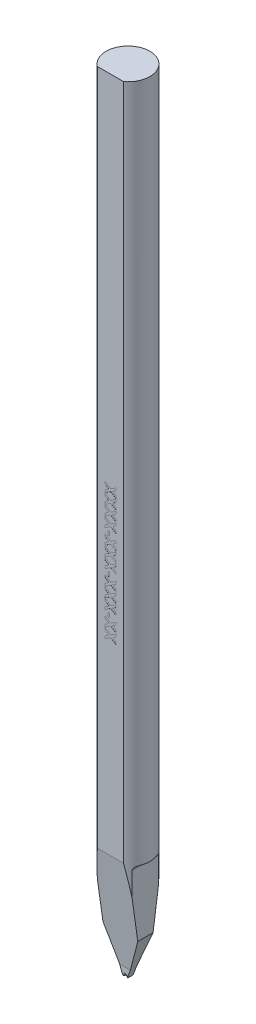
from build123d import *

# Parameters (mm, degrees)
SKETCH_TL_CUTTING_R       = 1.99771
TL_CUTTING_DEPTH          = 72.009
SKETCH_TDF_GRINDING_W     = 4.01542
SKETCH_TDF_GRINDING_H     = 4.01542
TDF_GRINDING_DEPTH        = 73.064400167
SKETCH_ENGRAVING_W        = 0.166666667
SKETCH_ENGRAVING_H        = 0.371794872
ENGRAVING_DEPTH           = 0.005
VW_VR_GRINDING_DEPTH      = 2.00771
VW_VR_GRINDING_DEPTH_BACK = 2.00771
ISA_GRINDING_DEPTH        = 2.00771
ISA_GRINDING_DEPTH_BACK   = 2.00771
PRE_FRX_BRX_DEPTH         = 2.00771
PRE_FRX_BRX_DEPTH_BACK    = 2.00771
SKETCH_PRE_FRX_BRX_W      = 1.7372
SKETCH_PRE_FRX_BRX_H      = 0.78994
FR_EDM_R                  = 0.20066
BR_EDM_R                  = 0.09906
FA_BA_GRINDING_DEPTH      = 2.00771
FA_BA_GRINDING_DEPTH_BACK = 2.00771


with BuildPart() as part:
    # sketch_TL_cutting → TL_cutting (new body)
    with BuildSketch(Plane(origin=(0, 0, 0), x_dir=(1, 0, 0), z_dir=(0, 1, 0))):
        with Locations(Location((0, 0, 0), (0, 0, 270))):
            Circle(SKETCH_TL_CUTTING_R)
    extrude(amount=TL_CUTTING_DEPTH)

    # sketch_TDF_grinding → TDF_grinding (cut, through all)
    with BuildSketch(Plane(origin=(0, 0, 0), x_dir=(1, 0, 0), z_dir=(0, 1, 0))):
        with Locations((0, -3.60918)):
            Rectangle(SKETCH_TDF_GRINDING_W, SKETCH_TDF_GRINDING_H)
    extrude(amount=TDF_GRINDING_DEPTH, mode=Mode.SUBTRACT)

    # sketch_engraving → engraving (cut)
    with BuildSketch(Plane.XY.offset(1.60147)):
        Polygon((-0.5, 39.598539744), (0.029647436, 39.255791346), (0.5, 39.560078205), (0.5, 39.33531859), (0.203325321, 39.143411538), (0.5, 38.951504487), (0.5, 38.726744872), (0.029647436, 39.031031731), (-0.5, 38.688283333), (-0.5, 38.913042949), (-0.144030449, 39.143411538), (-0.5, 39.373780128), align=None)
        Polygon((-0.5, 38.675462821), (0.029647436, 38.332714423), (0.5, 38.637001282), (0.5, 38.412241667), (0.203325321, 38.220334615), (0.5, 38.028427564), (0.5, 37.803667949), (0.029647436, 38.107954808), (-0.5, 37.76520641), (-0.5, 37.989966026), (-0.144030449, 38.220334615), (-0.5, 38.450703205), align=None)
        Polygon((-0.5, 37.752385897), (0.029647436, 37.4096375), (0.5, 37.713924359), (0.5, 37.489164744), (0.203325321, 37.297257692), (0.5, 37.105350641), (0.5, 36.880591026), (0.029647436, 37.184877885), (-0.5, 36.842129487), (-0.5, 37.066889103), (-0.144030449, 37.297257692), (-0.5, 37.527626282), align=None)
        Polygon((-0.5, 36.829308974), (0.029647436, 36.486560577), (0.5, 36.790847436), (0.5, 36.566087821), (0.203325321, 36.374180769), (0.5, 36.182273718), (0.5, 35.957514103), (0.029647436, 36.261800962), (-0.5, 35.919052564), (-0.5, 36.143812179), (-0.144030449, 36.374180769), (-0.5, 36.604549359), align=None)
        with Locations((-0.147435898, 35.649821795)):
            Rectangle(SKETCH_ENGRAVING_W, SKETCH_ENGRAVING_H)
        Polygon((-0.5, 35.44469359), (0.029647436, 35.101945192), (0.5, 35.406232051), (0.5, 35.181472436), (0.203325321, 34.989565385), (0.5, 34.797658333), (0.5, 34.572898718), (0.029647436, 34.877185577), (-0.5, 34.534437179), (-0.5, 34.759196795), (-0.144030449, 34.989565385), (-0.5, 35.219933974), align=None)
        Polygon((-0.5, 34.521616667), (0.029647436, 34.178868269), (0.5, 34.483155128), (0.5, 34.258395513), (0.203325321, 34.066488462), (0.5, 33.87458141), (0.5, 33.649821795), (0.029647436, 33.954108654), (-0.5, 33.611360256), (-0.5, 33.836119872), (-0.144030449, 34.066488462), (-0.5, 34.296857051), align=None)
        Polygon((-0.5, 33.598539744), (0.029647436, 33.255791346), (0.5, 33.560078205), (0.5, 33.33531859), (0.203325321, 33.143411538), (0.5, 32.951504487), (0.5, 32.726744872), (0.029647436, 33.031031731), (-0.5, 32.688283333), (-0.5, 32.913042949), (-0.144030449, 33.143411538), (-0.5, 33.373780128), align=None)
        with Locations((-0.147435898, 32.419052564)):
            Rectangle(SKETCH_ENGRAVING_W, SKETCH_ENGRAVING_H)
        Polygon((-0.5, 32.213924359), (0.029647436, 31.871175962), (0.5, 32.175462821), (0.5, 31.950703205), (0.203325321, 31.758796154), (0.5, 31.566889103), (0.5, 31.342129487), (0.029647436, 31.646416346), (-0.5, 31.303667949), (-0.5, 31.528427564), (-0.144030449, 31.758796154), (-0.5, 31.989164744), align=None)
        Polygon((-0.5, 31.290847436), (0.029647436, 30.948099038), (0.5, 31.252385897), (0.5, 31.027626282), (0.203325321, 30.835719231), (0.5, 30.643812179), (0.5, 30.419052564), (0.029647436, 30.723339423), (-0.5, 30.380591026), (-0.5, 30.605350641), (-0.144030449, 30.835719231), (-0.5, 31.066087821), align=None)
        Polygon((-0.5, 30.367770513), (0.029647436, 30.025022115), (0.5, 30.329308974), (0.5, 30.104549359), (0.203325321, 29.912642308), (0.5, 29.720735256), (0.5, 29.495975641), (0.029647436, 29.8002625), (-0.5, 29.457514103), (-0.5, 29.682273718), (-0.144030449, 29.912642308), (-0.5, 30.143010897), align=None)
        with Locations((-0.147435898, 29.188283333)):
            Rectangle(SKETCH_ENGRAVING_W, SKETCH_ENGRAVING_H)
        Polygon((-0.5, 28.983155128), (0.029647436, 28.640406731), (0.5, 28.94469359), (0.5, 28.719933974), (0.203325321, 28.528026923), (0.5, 28.336119872), (0.5, 28.111360256), (0.029647436, 28.415647115), (-0.5, 28.072898718), (-0.5, 28.297658333), (-0.144030449, 28.528026923), (-0.5, 28.758395513), align=None)
        Polygon((-0.5, 28.060078205), (0.029647436, 27.717329808), (0.5, 28.021616667), (0.5, 27.796857051), (0.203325321, 27.60495), (0.5, 27.413042949), (0.5, 27.188283333), (0.029647436, 27.492570192), (-0.5, 27.149821795), (-0.5, 27.37458141), (-0.144030449, 27.60495), (-0.5, 27.83531859), align=None)
    extrude(amount=-ENGRAVING_DEPTH, mode=Mode.SUBTRACT)

    # sketch_VW_VR_grinding → VW_VR_grinding (cut, two sides: drawn at the far end of the back side and taken through both)
    with BuildSketch(Plane.XY.offset(-VW_VR_GRINDING_DEPTH_BACK)):
        with BuildLine():
            Line((-1.59004, -0.01), (-1.59004, 9.681972))
            ThreePointArc((-1.59004, 9.681972), (-1.683182387, 9.906837613), (-1.908048, 9.99998))
            Line((-1.908048, 9.99998), (-2.00771, 9.99998))
            Line((-2.00771, 9.99998), (-2.00771, -0.01))
            Line((-2.00771, -0.01), (-1.59004, -0.01))
        make_face()
        with BuildLine():
            Line((1.59004, -0.01), (1.59004, 9.681972))
            ThreePointArc((1.59004, 9.681972), (1.683182387, 9.906837613), (1.908048, 9.99998))
            Line((1.908048, 9.99998), (2.00771, 9.99998))
            Line((2.00771, 9.99998), (2.00771, -0.01))
            Line((2.00771, -0.01), (1.59004, -0.01))
        make_face()
    extrude(amount=VW_VR_GRINDING_DEPTH + VW_VR_GRINDING_DEPTH_BACK, mode=Mode.SUBTRACT)

    # sketch_ISA_grinding → ISA_grinding (cut, two sides: drawn at the far end of the back side and taken through both)
    with BuildSketch(Plane.XY.offset(-ISA_GRINDING_DEPTH_BACK)):
        Polygon((-0.19939, 0), (-2.00771, 4.968318367), (-2.00771, -0.01), (2.00771, -0.01), (2.00771, 4.968318367), (0.19939, 0), align=None)
    extrude(amount=ISA_GRINDING_DEPTH + ISA_GRINDING_DEPTH_BACK, mode=Mode.SUBTRACT)

    # sketch_pre_FRX_BRX → pre_FRX_BRX (cut, two sides: drawn at the far end of the back side and taken through both)
    with BuildSketch(Plane(origin=(0, 0, 0), x_dir=(0, 0, -1), z_dir=(1, 0, 0)).offset(-PRE_FRX_BRX_DEPTH_BACK)):
        with Locations((-1.13911, 0.38497)):
            Rectangle(SKETCH_PRE_FRX_BRX_W, SKETCH_PRE_FRX_BRX_H)
        with Locations((1.13911, 0.38497)):
            Rectangle(SKETCH_PRE_FRX_BRX_W, SKETCH_PRE_FRX_BRX_H)
    extrude(amount=PRE_FRX_BRX_DEPTH + PRE_FRX_BRX_DEPTH_BACK, mode=Mode.SUBTRACT)

    # V-Groove_EDM: sweep along a path in sketch_contour_V-Groove
    with BuildLine(Plane(origin=(0, 0, 0), x_dir=(0, 0, -1), z_dir=(1, 0, 0))) as v_groove_edm_path:
        Line((-1.60147, 0.11176), (0, 0.11176))
        Line((0, 0.11176), (1.99771, 0.11176))
    # sketch_section_V-Groove → V-Groove_EDM (sweep, cut)
    with BuildSketch(Plane.XY.offset(1.60147)):
        with BuildLine():
            Line((-1.23952, -1.1176), (-0.017344205, 0.104575795))
            ThreePointArc((-0.017344205, 0.104575795), (0, 0.11176), (0.017344205, 0.104575795))
            Line((0.017344205, 0.104575795), (1.23952, -1.1176))
            Line((1.23952, -1.1176), (-1.23952, -1.1176))
        make_face()
    sweep(path=v_groove_edm_path.line, mode=Mode.SUBTRACT)

    # FR_EDM
    fr_edm_edges = [part.edges().sort_by_distance(p)[0] for p in [
        (0.069632102, 0.052287898, 0.27051),
        (0, 0.11176, 0.27051),
        (-0.069632102, 0.052287898, 0.27051),
    ]]
    fillet(fr_edm_edges, radius=FR_EDM_R)

    # BR_EDM
    br_edm_edges = [part.edges().sort_by_distance(p)[0] for p in [
        (0.069632102, 0.052287898, -0.27051),
        (0, 0.11176, -0.27051),
        (-0.069632102, 0.052287898, -0.27051),
    ]]
    fillet(br_edm_edges, radius=BR_EDM_R)

    # sketch_FA_BA_grinding → FA_BA_grinding (cut, two sides: drawn at the far end of the back side and taken through both)
    with BuildSketch(Plane(origin=(0, 0, 0), x_dir=(0, 0, -1), z_dir=(1, 0, 0)).offset(-FA_BA_GRINDING_DEPTH_BACK)):
        Polygon((2.99771, 20.194976307), (2.99771, -0.1), (0.27051, -0.1), (0.27051, 0.78994), align=None)
        Polygon((-3.218218656, 21.763976919), (-0.27051, 0.78994), (-0.27051, -0.1), (-3.218218656, -0.1), align=None)
    extrude(amount=FA_BA_GRINDING_DEPTH + FA_BA_GRINDING_DEPTH_BACK, mode=Mode.SUBTRACT)


solid = part.part
